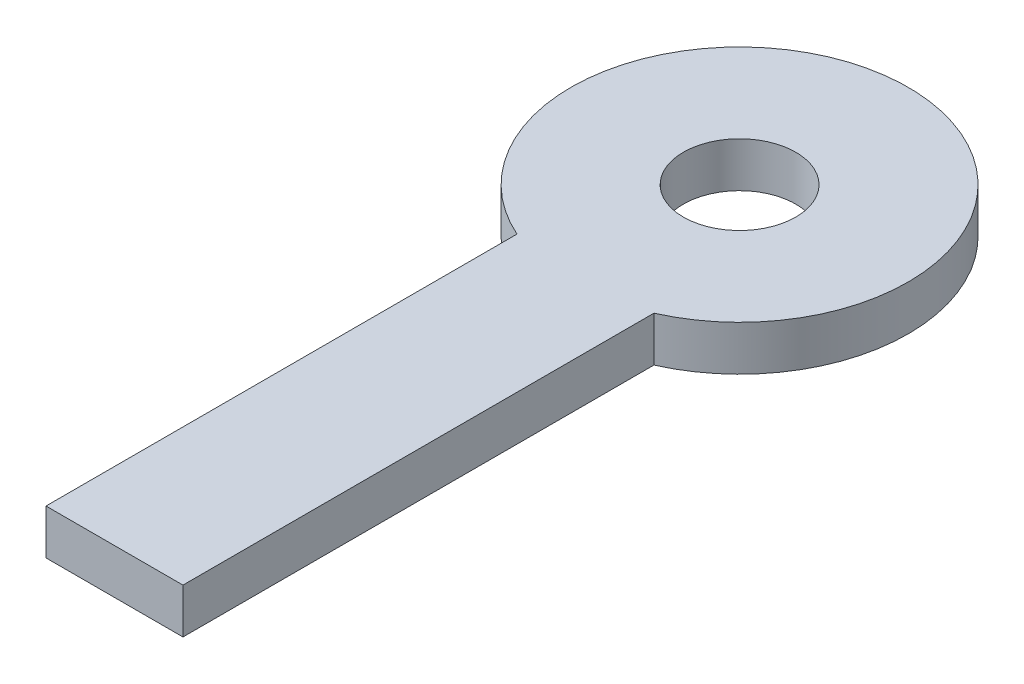
from build123d import *

# Parameters (mm, degrees)
SKETCH2_R           = 12.7
BOSS_EXTRUDE2_DEPTH = 10.16


with BuildPart() as part:
    # Sketch2 → Boss-Extrude2 (new body)
    with BuildSketch(Plane(origin=(0, 0, 0), x_dir=(1, 0, 0), z_dir=(0, 1, 0))):
        with BuildLine():
            Line((-15.471133586, -34.817438527), (-15.471133586, -141.218475005))
            Line((-15.471133586, -141.218475005), (15.471133586, -141.218475005))
            Line((15.471133586, -141.218475005), (15.471133586, -34.817438527))
            ThreePointArc((15.471133586, -34.817438527), (0, 38.1), (-15.471133586, -34.817438527))
        make_face()
        with Locations(Location((0, 0, 0), (0, 0, 270))):
            Circle(SKETCH2_R, mode=Mode.SUBTRACT)
    extrude(amount=BOSS_EXTRUDE2_DEPTH)


solid = part.part
